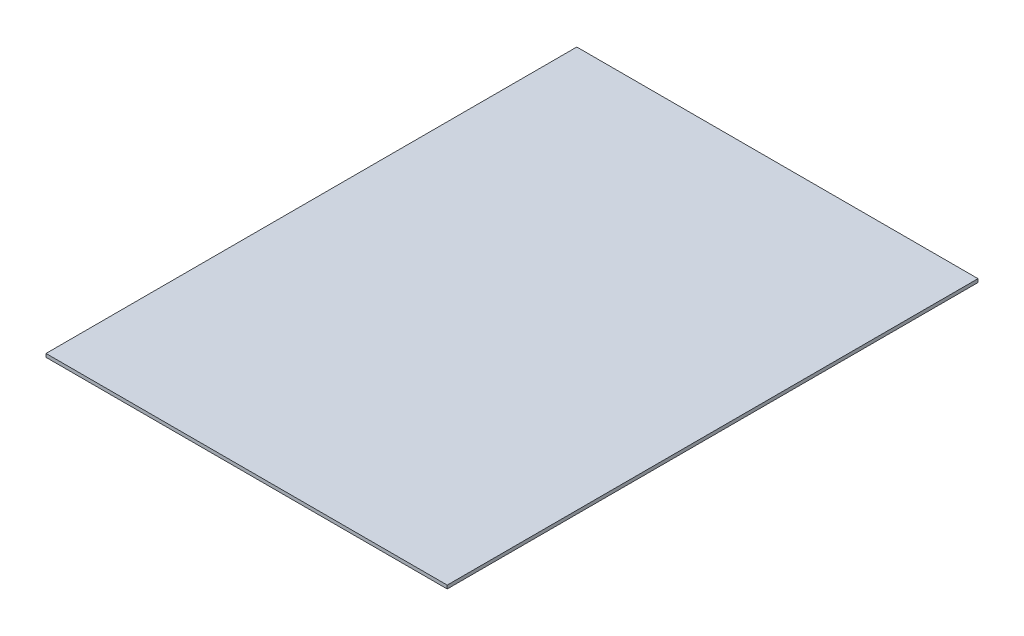
from build123d import *

# Parameters (mm, degrees)
SKETCH1_W           = 374.396
SKETCH1_H           = 495.3
BOSS_EXTRUDE1_DEPTH = 1.5875


with BuildPart() as part:
    # Sketch1 → Boss-Extrude1 (new, symmetric)
    with BuildSketch(Plane(origin=(0, 0, 0), x_dir=(1, 0, 0), z_dir=(0, 1, 0))):
        Rectangle(SKETCH1_W, SKETCH1_H)
    extrude(amount=BOSS_EXTRUDE1_DEPTH, both=True)


solid = part.part
